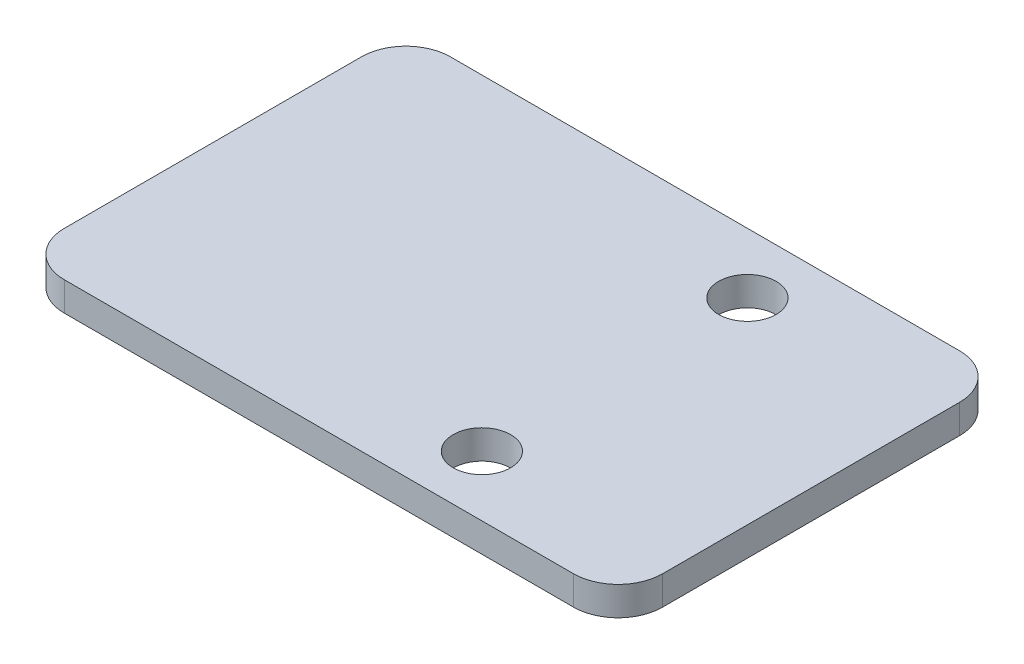
from build123d import *

# Parameters (mm, degrees)
SKETCH1_W           = 34.13125
SKETCH1_H           = 22.0265625
BOSS_EXTRUDE1_DEPTH = 1.651
FILLET1_R           = 2.54
SKETCH2_R           = 1.64
CUT_EXTRUDE1_DEPTH  = 2.54


with BuildPart() as part:
    # Sketch1 → Boss-Extrude1 (new body)
    with BuildSketch(Plane(origin=(0, 0, 0), x_dir=(1, 0, 0), z_dir=(0, 1, 0))):
        with Locations((17.065625, 11.01328125)):
            Rectangle(SKETCH1_W, SKETCH1_H)
    extrude(amount=BOSS_EXTRUDE1_DEPTH)

    # Fillet1
    fillet1_edges = [part.edges().sort_by_distance(p)[0] for p in [
        (0, 0.8255, 0),
        (0, 0.8255, -22.0265625),
        (34.13125, 0.8255, -22.0265625),
        (34.13125, 0.8255, 0),
    ]]
    fillet(fillet1_edges, radius=FILLET1_R)

    # Sketch2 → Cut-Extrude1 (cut)
    with BuildSketch(Plane(origin=(0, 1.651, 0), x_dir=(1, 0, 0), z_dir=(0, 1, 0))):
        with Locations((22.92125, 18.5865625)):
            Circle(SKETCH2_R)
        with Locations((22.92125, 3.44)):
            Circle(SKETCH2_R)
    extrude(amount=-CUT_EXTRUDE1_DEPTH, mode=Mode.SUBTRACT)


solid = part.part
